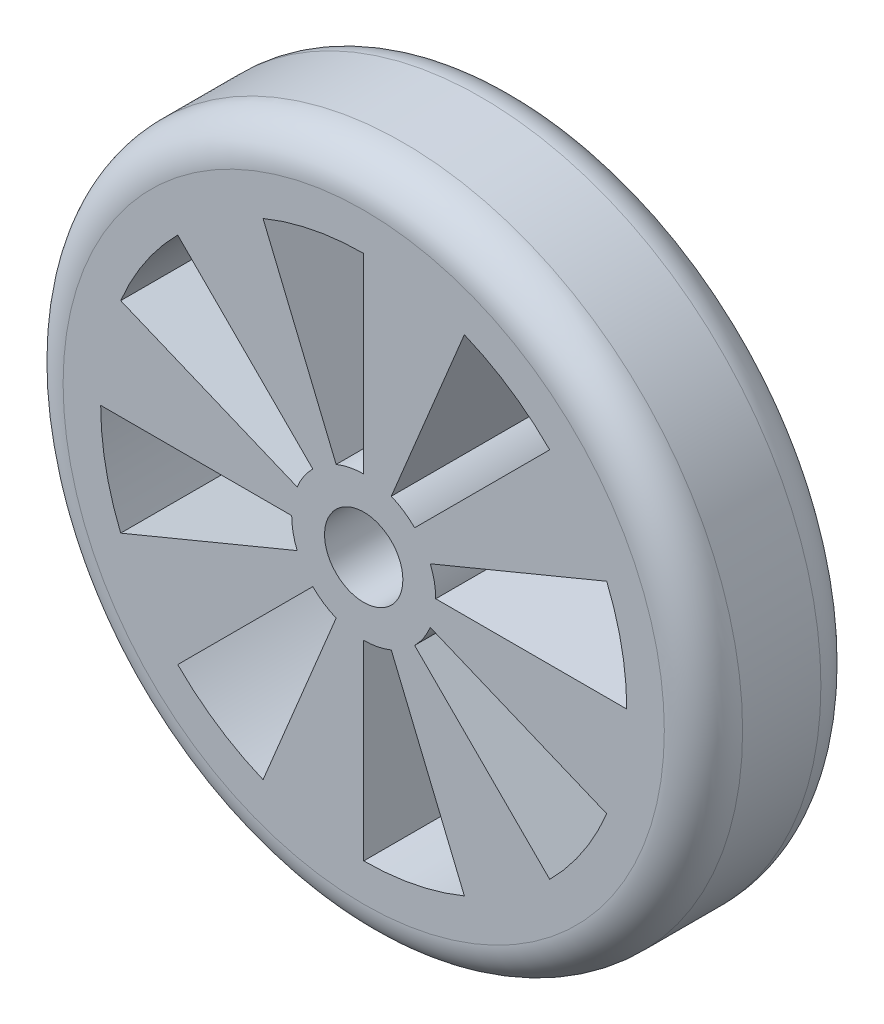
from build123d import *

# Parameters (mm, degrees)
SKETCH1_R               = 217
BOSS_EXTRUDE1_DEPTH     = 100
FILLET1_R               = 25
FILLET2_R               = 25
CUT_EXTRUDE4_DEPTH      = 20000
CUT_EXTRUDE4_DEPTH_BACK = 20000
CUT_EXTRUDE5_DEPTH      = 20000
CUT_EXTRUDE5_DEPTH_BACK = 20000
SKETCH8_R               = 25


with BuildPart() as part:
    # Sketch1 → Boss-Extrude1 (new body)
    with BuildSketch(Plane.XY):
        Circle(SKETCH1_R)
    extrude(amount=BOSS_EXTRUDE1_DEPTH)

    # Fillet1
    fillet1_edges = [part.edges().sort_by_distance(p)[0] for p in [
        (-217, 0, 100),
    ]]
    fillet(fillet1_edges, radius=FILLET1_R)

    # Fillet2
    fillet2_edges = [part.edges().sort_by_distance(p)[0] for p in [
        (-217, 0, 0),
    ]]
    fillet(fillet2_edges, radius=FILLET2_R)

    # Sketch3 → Cut-Extrude4 (cut, two sides: drawn at the far end of the back side and taken through both)
    with BuildSketch(Plane.XY.offset(-CUT_EXTRUDE4_DEPTH_BACK)):
        with BuildLine():
            ThreePointArc((-46, 0), (-45.116122899, -8.974154813), (-42.498458496, -17.603437889))
            Line((-42.498458496, -17.603437889), (-155.211761462, -64.290816637))
            ThreePointArc((-155.211761462, -64.290816637), (-164.771927108, -32.775174099), (-168, 0))
            Line((-168, 0), (-46, 0))
        make_face()
        with BuildLine():
            ThreePointArc((0, -46), (8.974154813, -45.116122899), (17.603437889, -42.498458496))
            Line((17.603437889, -42.498458496), (64.290816637, -155.211761462))
            ThreePointArc((64.290816637, -155.211761462), (32.775174099, -164.771927108), (0, -168))
            Line((0, -168), (0, -46))
        make_face()
        with BuildLine():
            ThreePointArc((32.526911935, -32.526911935), (38.247602166, -25.556230719), (42.498458496, -17.603437889))
            Line((42.498458496, -17.603437889), (155.211761462, -64.290816637))
            ThreePointArc((155.211761462, -64.290816637), (139.686894867, -93.335799147), (118.793939239, -118.793939239))
            Line((118.793939239, -118.793939239), (32.526911935, -32.526911935))
        make_face()
        with BuildLine():
            ThreePointArc((46, 0), (45.116122899, 8.974154813), (42.498458496, 17.603437889))
            Line((42.498458496, 17.603437889), (155.211761462, 64.290816637))
            ThreePointArc((155.211761462, 64.290816637), (164.771927108, 32.775174099), (168, 0))
            Line((168, 0), (46, 0))
        make_face()
        with BuildLine():
            ThreePointArc((32.526911935, 32.526911935), (25.556230719, 38.247602166), (17.603437889, 42.498458496))
            Line((17.603437889, 42.498458496), (64.290816637, 155.211761462))
            ThreePointArc((64.290816637, 155.211761462), (93.335799147, 139.686894867), (118.793939239, 118.793939239))
            Line((118.793939239, 118.793939239), (32.526911935, 32.526911935))
        make_face()
        with BuildLine():
            Line((0, 46), (0, 168))
            ThreePointArc((0, 168), (-32.775174099, 164.771927108), (-64.290816637, 155.211761462))
            Line((-64.290816637, 155.211761462), (-17.603437889, 42.498458496))
            ThreePointArc((-17.603437889, 42.498458496), (-8.974154813, 45.116122899), (0, 46))
        make_face()
        with BuildLine():
            Line((-42.498458496, 17.603437889), (-155.211761462, 64.290816637))
            ThreePointArc((-155.211761462, 64.290816637), (-139.686894867, 93.335799147), (-118.793939239, 118.793939239))
            Line((-118.793939239, 118.793939239), (-32.526911935, 32.526911935))
            ThreePointArc((-32.526911935, 32.526911935), (-38.247602166, 25.556230719), (-42.498458496, 17.603437889))
        make_face()
        with BuildLine():
            Line((-17.603437889, -42.498458496), (-64.290816637, -155.211761462))
            ThreePointArc((-64.290816637, -155.211761462), (-93.335799147, -139.686894867), (-118.793939239, -118.793939239))
            Line((-118.793939239, -118.793939239), (-32.526911935, -32.526911935))
            ThreePointArc((-32.526911935, -32.526911935), (-25.556230719, -38.247602166), (-17.603437889, -42.498458496))
        make_face()
    extrude(amount=CUT_EXTRUDE4_DEPTH + CUT_EXTRUDE4_DEPTH_BACK, mode=Mode.SUBTRACT)

    # Sketch8 → Cut-Extrude5 (cut, two sides: drawn at the far end of the back side and taken through both)
    with BuildSketch(Plane.XY.offset(-CUT_EXTRUDE5_DEPTH_BACK)):
        Circle(SKETCH8_R)
    extrude(amount=CUT_EXTRUDE5_DEPTH + CUT_EXTRUDE5_DEPTH_BACK, mode=Mode.SUBTRACT)


solid = part.part
